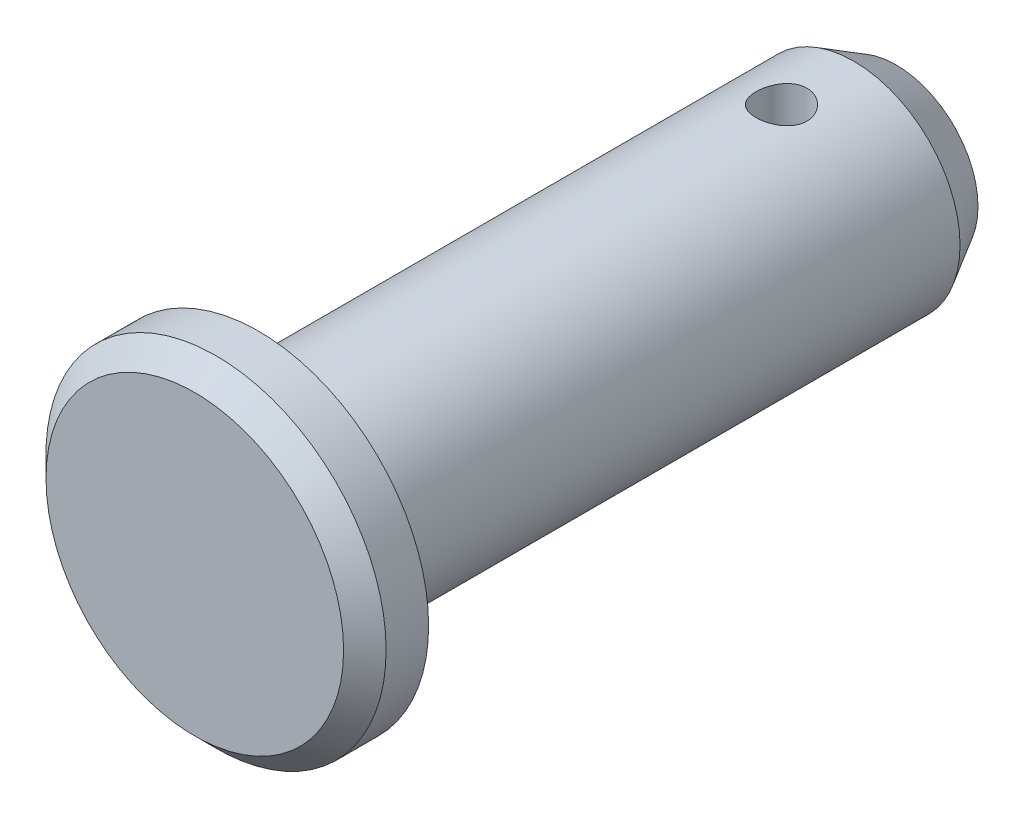
from build123d import *

# Parameters (mm, degrees)
WYTNIJ_WYCI_GNI_CIE1_DEPTH      = 11.003124512
WYTNIJ_WYCI_GNI_CIE1_DEPTH_BACK = 11.003124512
SZKIC2_R                        = 0.6


with BuildPart() as part:
    # Szkic1 → Obrót1 (revolve)
    with BuildSketch(Plane(origin=(0, 0, 0), x_dir=(1, 0, 0), z_dir=(0, 1, 0))):
        Polygon((0, -8.25), (3.5, -8.25), (4, -7.75), (4, -6.75), (2.5, -6.75), (2.5, 7.25), (1.922649731, 8.25), (0, 8.25), align=None)
    revolve(axis=Axis((0, 0, 8.25), (0, 0, -1)))

    # Szkic2 → Wytnij-wyciągnięcie1 (cut, two sides: drawn at the far end of the back side and taken through both)
    with BuildSketch(Plane(origin=(0, 0, 0), x_dir=(1, 0, 0), z_dir=(0, 1, 0)).offset(-WYTNIJ_WYCI_GNI_CIE1_DEPTH_BACK)):
        with Locations(Location((0, 5.55, 0), (0, 0, 270))):
            Circle(SZKIC2_R)
    extrude(amount=WYTNIJ_WYCI_GNI_CIE1_DEPTH + WYTNIJ_WYCI_GNI_CIE1_DEPTH_BACK, mode=Mode.SUBTRACT)


solid = part.part
